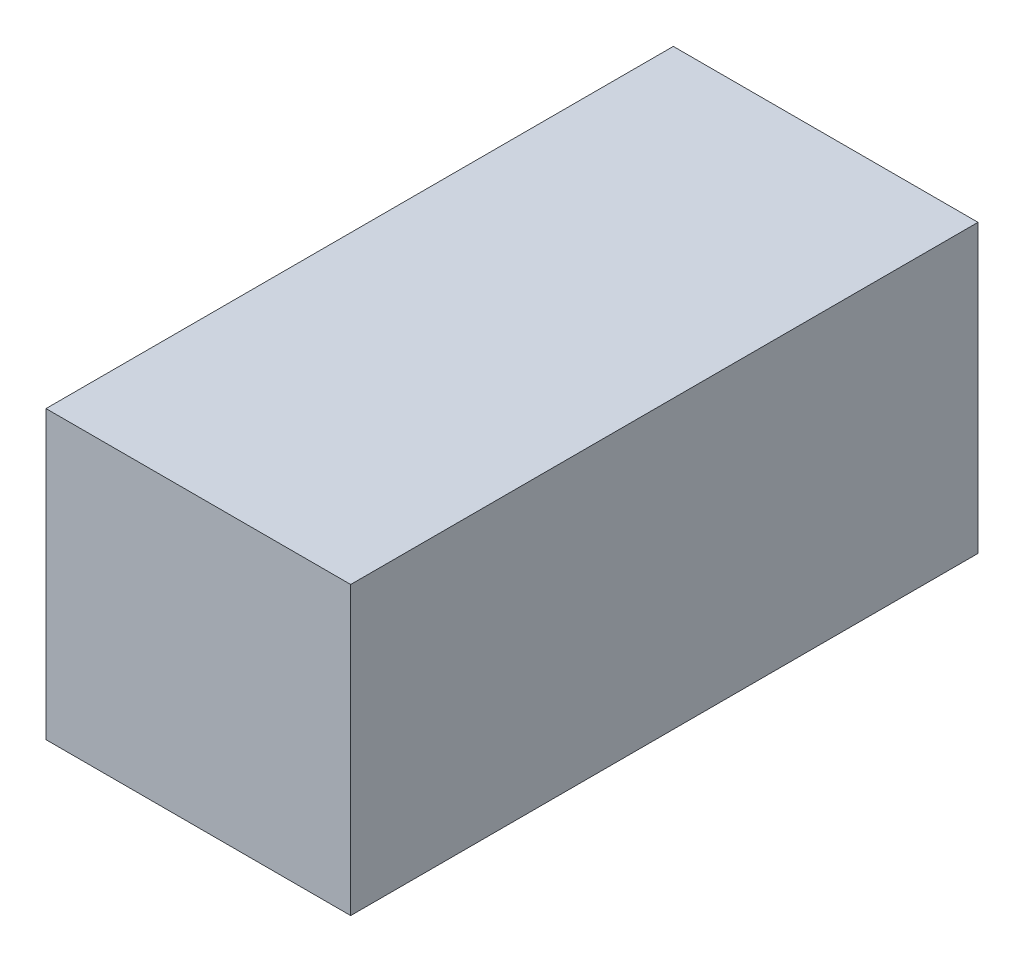
from build123d import *

# Parameters (mm, degrees)
SKETCH1_W           = 8.636
SKETCH1_H           = 17.78
BOSS_EXTRUDE1_DEPTH = 8.128


with BuildPart() as part:
    # Sketch1 → Boss-Extrude1 (new body)
    with BuildSketch(Plane(origin=(0, 0, 0), x_dir=(1, 0, 0), z_dir=(0, 1, 0))):
        with Locations((19.165018868, 2.348301887)):
            Rectangle(SKETCH1_W, SKETCH1_H)
    extrude(amount=BOSS_EXTRUDE1_DEPTH)


solid = part.part
